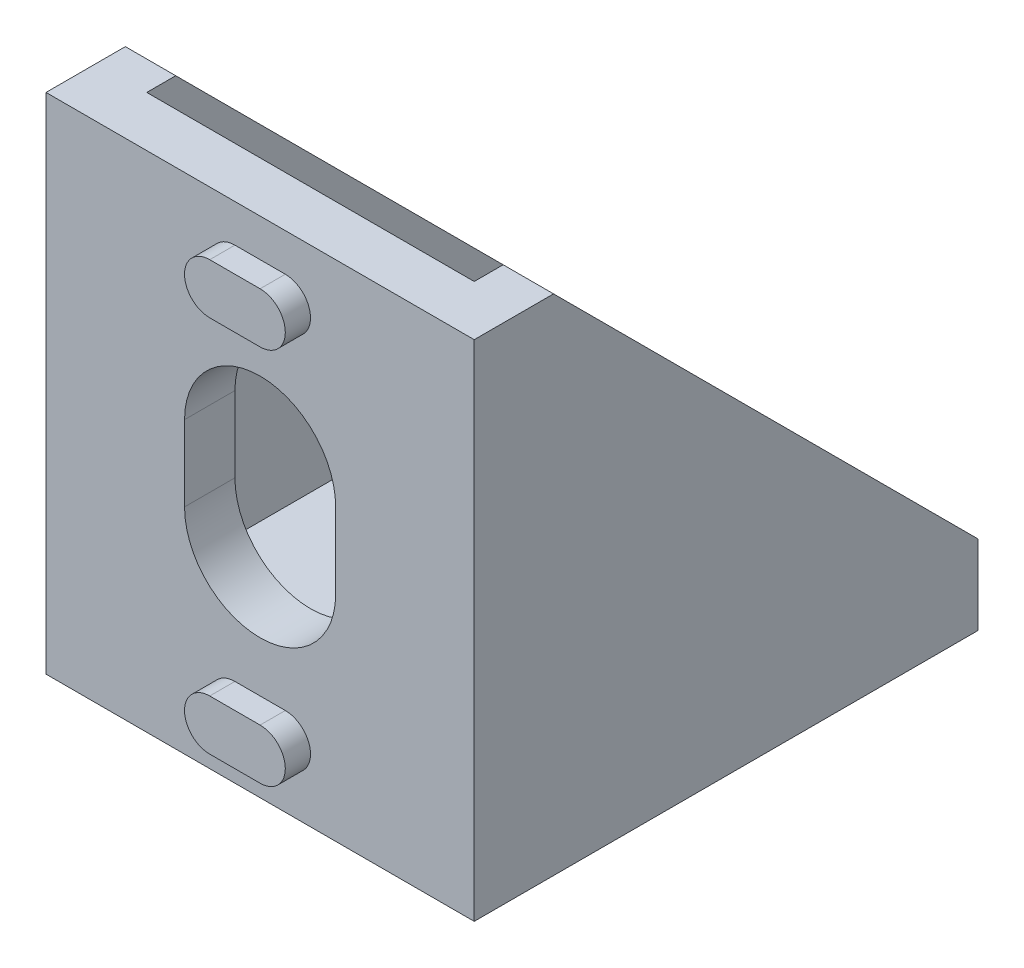
from build123d import *

# Parameters (mm, degrees)
BOSS_EXTRUDE1_DEPTH = 2
BOSS_EXTRUDE2_DEPTH = 6.5
CUT_EXTRUDE1_DEPTH  = 6.5
CUT_EXTRUDE2_DEPTH  = 6.5
BOSS_EXTRUDE3_DEPTH = 1
BOSS_EXTRUDE4_DEPTH = 1


with BuildPart() as part:
    # Sketch1 → Boss-Extrude1 (new body)
    with BuildSketch(Plane(origin=(0, 0, 0), x_dir=(0, 0, -1), z_dir=(1, 0, 0))):
        Polygon((3.15, 20), (20, 3.15), (20, 0), (0, 0), (0, 20), align=None)
    extrude(amount=BOSS_EXTRUDE1_DEPTH)

    # Sketch2 → Boss-Extrude2 (add)
    with BuildSketch(Plane(origin=(2, 0, 0), x_dir=(0, 0, -1), z_dir=(1, 0, 0))):
        Polygon((20, 0), (0, 0), (0, 3), (0, 20), (2, 20), (2, 3), (20, 3), align=None)
    extrude(amount=BOSS_EXTRUDE2_DEPTH)

    # Sketch3 → Cut-Extrude1 (cut)
    with BuildSketch(Plane.XY):
        with BuildLine():
            Line((5.5, 11.5), (5.5, 8.5))
            ThreePointArc((5.5, 8.5), (6.378679656, 6.378679656), (8.5, 5.5))
            Line((8.5, 5.5), (8.5, 14.5))
            ThreePointArc((8.5, 14.5), (6.378679656, 13.621320344), (5.5, 11.5))
        make_face()
    extrude(amount=-CUT_EXTRUDE1_DEPTH, mode=Mode.SUBTRACT)

    # Sketch4 → Cut-Extrude2 (cut)
    with BuildSketch(Plane.XZ):
        with BuildLine():
            Line((5.5, -8.5), (5.5, -11.5))
            ThreePointArc((5.5, -11.5), (6.378679656, -13.621320344), (8.5, -14.5))
            Line((8.5, -14.5), (8.5, -5.5))
            ThreePointArc((8.5, -5.5), (6.378679656, -6.378679656), (5.5, -8.5))
        make_face()
    extrude(amount=-CUT_EXTRUDE2_DEPTH, mode=Mode.SUBTRACT)

    # Sketch5 → Boss-Extrude3 (add)
    with BuildSketch(Plane(origin=(0, 0, 0), x_dir=(-1, 0, 0), z_dir=(0, -1, 0))):
        with BuildLine():
            Line((-7.5, 1.5), (-8.5, 1.5))
            Line((-8.5, 1.5), (-8.5, 3.5))
            Line((-8.5, 3.5), (-7.5, 3.5))
            ThreePointArc((-7.5, 3.5), (-6.5, 2.5), (-7.5, 1.5))
        make_face()
        with BuildLine():
            Line((-8.5, 18.5), (-8.5, 16.5))
            Line((-8.5, 16.5), (-7.5, 16.5))
            ThreePointArc((-7.5, 16.5), (-6.5, 17.5), (-7.5, 18.5))
            Line((-7.5, 18.5), (-8.5, 18.5))
        make_face()
    extrude(amount=BOSS_EXTRUDE3_DEPTH)

    # Sketch6 → Boss-Extrude4 (add)
    with BuildSketch(Plane.XY):
        with BuildLine():
            Line((7.5, 18.5), (8.5, 18.5))
            Line((8.5, 18.5), (8.5, 16.5))
            Line((8.5, 16.5), (7.5, 16.5))
            ThreePointArc((7.5, 16.5), (6.5, 17.5), (7.5, 18.5))
        make_face()
        with BuildLine():
            Line((8.5, 1.5), (8.5, 3.5))
            Line((8.5, 3.5), (7.5, 3.5))
            ThreePointArc((7.5, 3.5), (6.5, 2.5), (7.5, 1.5))
            Line((7.5, 1.5), (8.5, 1.5))
        make_face()
    extrude(amount=BOSS_EXTRUDE4_DEPTH)

    # Mirror2: part across plane


with BuildPart() as part_1:
    add(part.part)
    add(part.part.mirror(Plane(origin=(8.5, 0, 0), x_dir=(0, 0, 1), z_dir=(1, 0, 0))))


solid = part_1.part
